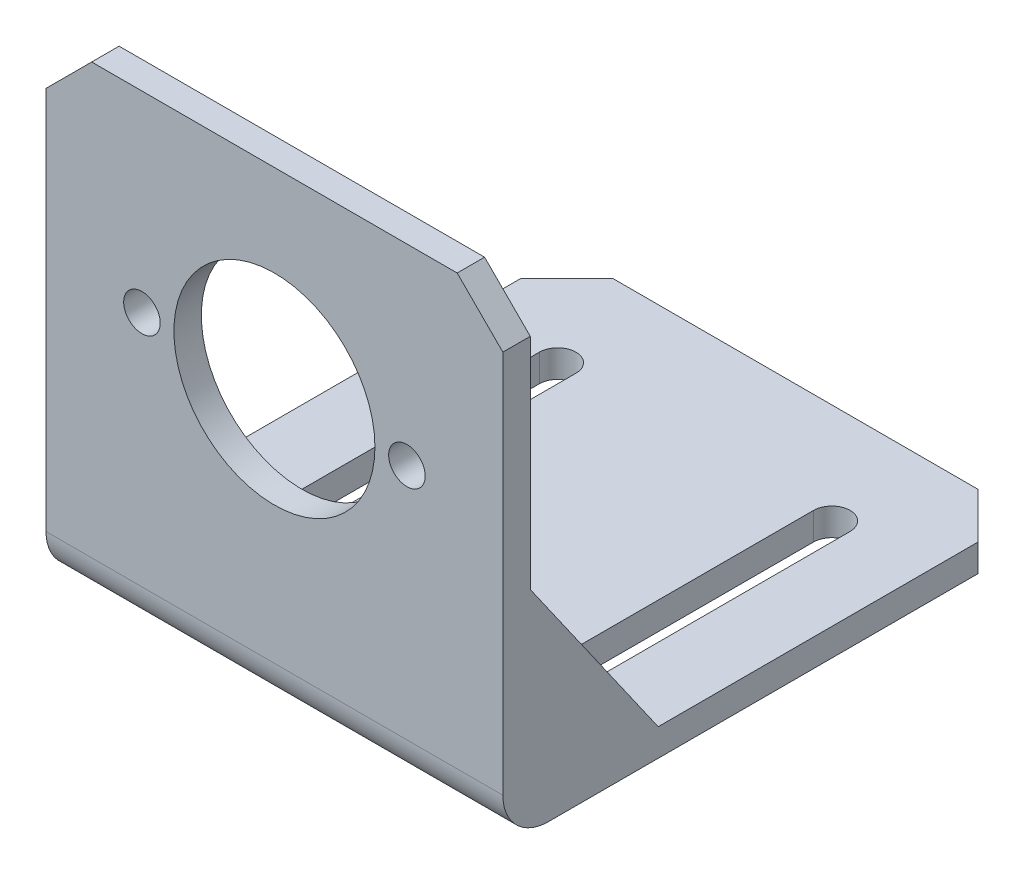
from build123d import *

# Parameters (mm, degrees)
SKETCH_1_W          = 50
SKETCH_1_H          = 52
EXTRUDE_1_DEPTH     = 3
SKETCH_2_W          = 50
SKETCH_2_H          = 3
EXTRUDE_2_DEPTH     = 54
SKETCH_3_R          = 11
SKETCH_3_R_2        = 2
CUT_EXTRUDE_1_DEPTH = 68.453687816
CHAMFER_1_SIZE      = 5
CHAMFER_2_SIZE      = 5
CUT_EXTRUDE_2_DEPTH = 80.025312401
EXTRUDE_START       = -50
EXTRUDE_3_DEPTH     = 50
CUT_EXTRUDE_START   = -3
CUT_EXTRUDE_3_DEPTH = 44
FILLET_1_R          = 5


with BuildPart() as part:
    # 草圖1 → 填料-伸長1 (new body)
    with BuildSketch(Plane.XY):
        Rectangle(SKETCH_1_W, SKETCH_1_H)
    extrude(amount=EXTRUDE_1_DEPTH)

    # 草圖2 → 填料-伸長2 (add)
    with BuildSketch(Plane(origin=(0, 0, 0), x_dir=(-1, 0, 0), z_dir=(0, 0, -1))):
        with Locations((0, -24.5)):
            Rectangle(SKETCH_2_W, SKETCH_2_H)
    extrude(amount=EXTRUDE_2_DEPTH)

    # 草圖3 → 除料-伸長1 (cut, through all)
    with BuildSketch(Plane.XY.offset(3)):
        with Locations((0, 5)):
            Circle(SKETCH_3_R)
        with Locations((14.5, 5)):
            Circle(SKETCH_3_R_2)
        with Locations((-14.5, 5)):
            Circle(SKETCH_3_R_2)
    extrude(amount=-CUT_EXTRUDE_1_DEPTH, mode=Mode.SUBTRACT)

    # 導角1
    chamfer_1_edges = [part.edges().sort_by_distance(p)[0] for p in [
        (-25, 26, 1.5),
        (25, 26, 1.5),
    ]]
    chamfer(chamfer_1_edges, length=CHAMFER_1_SIZE)

    # 導角2
    chamfer_2_edges = [part.edges().sort_by_distance(p)[0] for p in [
        (25, -24.5, -54),
        (-25, -24.5, -54),
    ]]
    chamfer(chamfer_2_edges, length=CHAMFER_2_SIZE)

    # 草圖4 → 除料-伸長2 (cut, through all)
    with BuildSketch(Plane.XZ.offset(26)):
        with BuildLine():
            Line((13, -43), (13, -13))
            ThreePointArc((13, -13), (15, -11), (17, -13))
            Line((17, -13), (17, -43))
            ThreePointArc((17, -43), (15, -45), (13, -43))
        make_face()
        with BuildLine():
            Line((-13, -43), (-13, -13))
            ThreePointArc((-13, -13), (-15, -11), (-17, -13))
            Line((-17, -13), (-17, -43))
            ThreePointArc((-17, -43), (-15, -45), (-13, -43))
        make_face()
    extrude(amount=-CUT_EXTRUDE_2_DEPTH, mode=Mode.SUBTRACT)

    # 草圖5 → 填料-伸長3 (add)
    with BuildSketch(Plane(origin=(25, 0, 0), x_dir=(0, 0, -1), z_dir=(1, 0, 0)).offset(EXTRUDE_START)):
        Polygon((0, -23), (0, -3), (14, -23), align=None)
    extrude(amount=EXTRUDE_3_DEPTH)

    # 草圖6 → 除料-伸長3 (cut)
    with BuildSketch(Plane(origin=(25, 0, 0), x_dir=(0, 0, -1), z_dir=(1, 0, 0)).offset(CUT_EXTRUDE_START)):
        Polygon((0, -3), (14, -23), (0, -23), align=None)
    extrude(amount=-CUT_EXTRUDE_3_DEPTH, mode=Mode.SUBTRACT)

    # 圓角1
    fillet_1_edges = [part.edges().sort_by_distance(p)[0] for p in [
        (0, -26, 3),
    ]]
    fillet(fillet_1_edges, radius=FILLET_1_R)


solid = part.part
